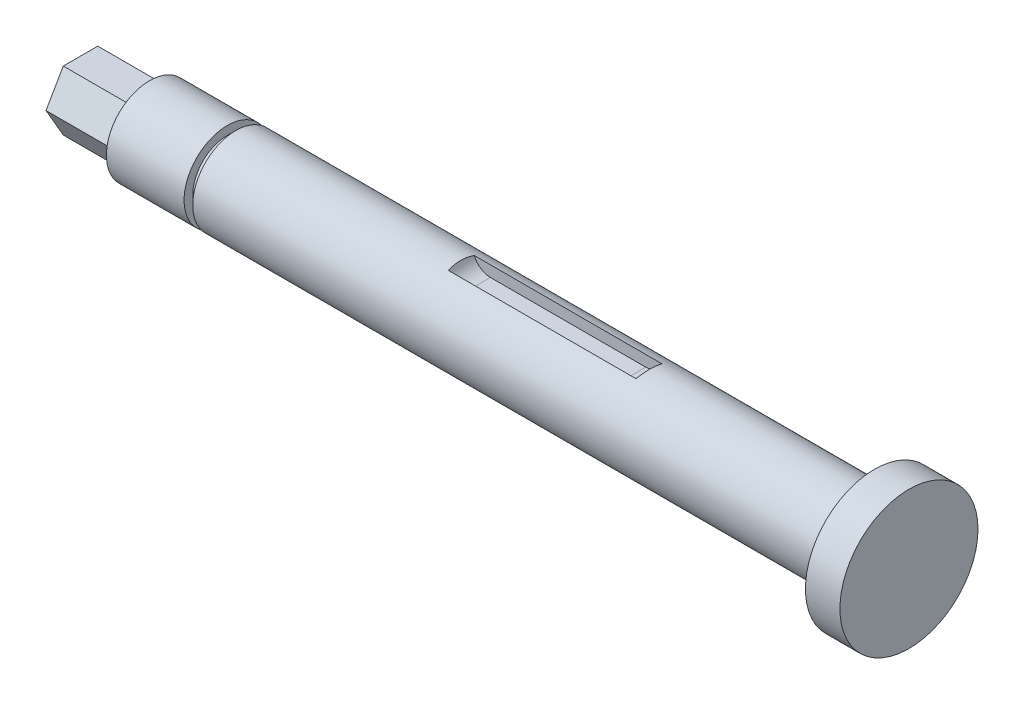
from build123d import *

# Parameters (mm, degrees)
CUT_EXTRUDE1_DEPTH = 2.38125
SKETCH3_OUTSIDE_W  = 58.716
SKETCH3_OUTSIDE_H  = 58.716
CUT_EXTRUDE2_DEPTH = 12.7


with BuildPart() as part:
    # Sketch1 → Base (revolve)
    with BuildSketch(Plane.XY, mode=Mode.PRIVATE) as base_sk:
        Polygon((0, 0), (0, 6.35), (12.7, 6.35), (12.7, 7.9375), (26.9875, 7.9375), (26.9875, 6.35), (28.575, 6.35), (28.575, 7.9375), (146.05, 7.9375), (146.05, 12.7), (152.4, 12.7), (152.4, 0), align=None)
    revolve(base_sk.sketch.rotate(Axis((0, 0, 0), (-1, 0, 0)), 90), axis=Axis((0, 0, 0), (-1, 0, 0)))

    # Sketch2 → Cut-Extrude1 (cut, symmetric)
    with BuildSketch(Plane.XY):
        with BuildLine():
            Line((69.85, 14.2875), (69.85, 8.7249))
            ThreePointArc((69.85, 8.7249), (70.77993597, 6.47983597), (73.025, 5.5499))
            Line((73.025, 5.5499), (101.6, 5.5499))
            ThreePointArc((101.6, 5.5499), (103.84506403, 6.47983597), (104.775, 8.7249))
            Line((104.775, 8.7249), (104.775, 14.2875))
            Line((104.775, 14.2875), (69.85, 14.2875))
        make_face()
    extrude(amount=CUT_EXTRUDE1_DEPTH, both=True, mode=Mode.SUBTRACT)

    # Sketch3 outside → Cut-Extrude2 (cut)
    with BuildSketch(Plane.ZY):
        Rectangle(SKETCH3_OUTSIDE_W, SKETCH3_OUTSIDE_H)
        Polygon((3.175, 5.499261314), (-3.175, 5.499261314), (-6.35, 0), (-3.175, -5.499261314), (3.175, -5.499261314), (6.35, 0), align=None, mode=Mode.SUBTRACT)
    extrude(amount=-CUT_EXTRUDE2_DEPTH, mode=Mode.SUBTRACT)


solid = part.part
